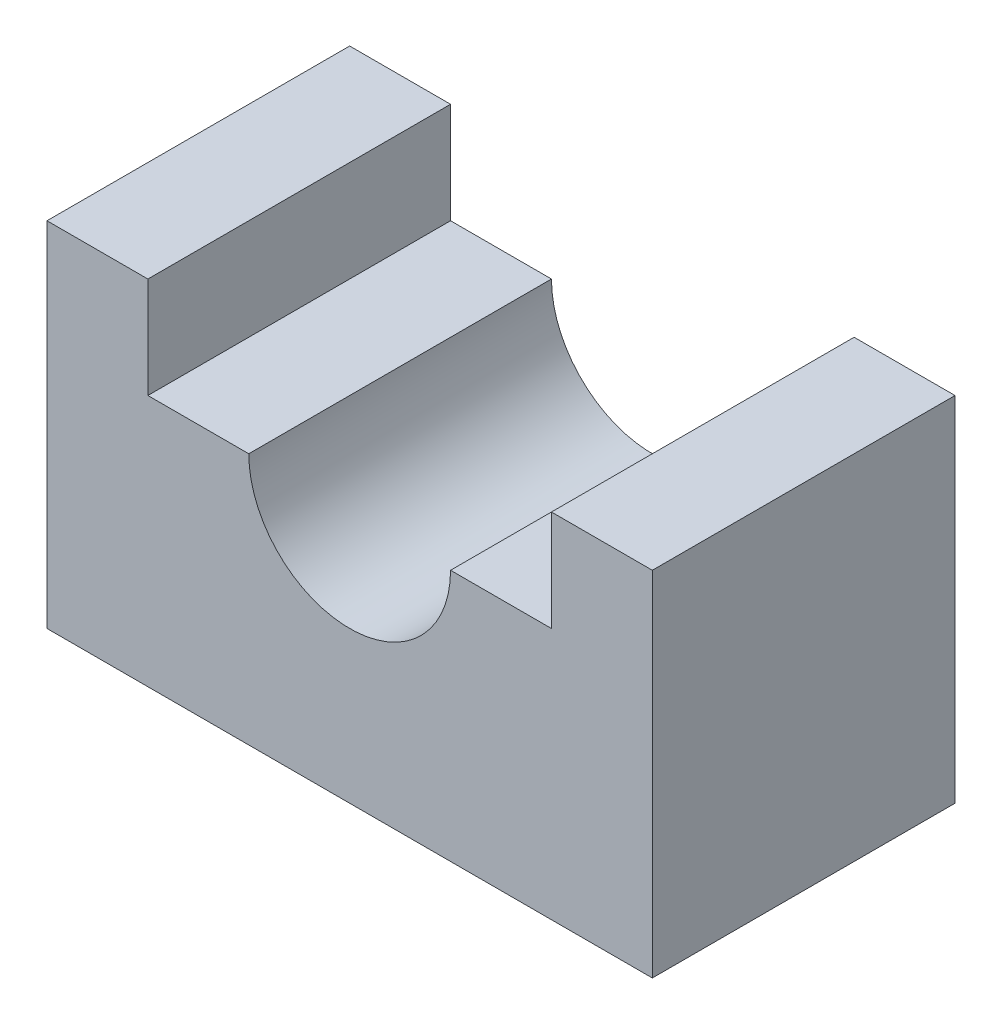
from build123d import *

# Parameters (mm, degrees)
BOSS_EXTRUDE1_DEPTH = 15


with BuildPart() as part:
    # Sketch1 → Boss-Extrude1 (new, symmetric)
    with BuildSketch(Plane.XY):
        with BuildLine():
            Line((-20, 35), (-20, 25))
            Line((-20, 25), (-10, 25))
            ThreePointArc((-10, 25), (0, 15), (10, 25))
            Line((10, 25), (20, 25))
            Line((20, 25), (20, 35))
            Line((20, 35), (30, 35))
            Line((30, 35), (30, 0))
            Line((30, 0), (-30, 0))
            Line((-30, 0), (-30, 35))
            Line((-30, 35), (-20, 35))
        make_face()
    extrude(amount=BOSS_EXTRUDE1_DEPTH, both=True)


solid = part.part
